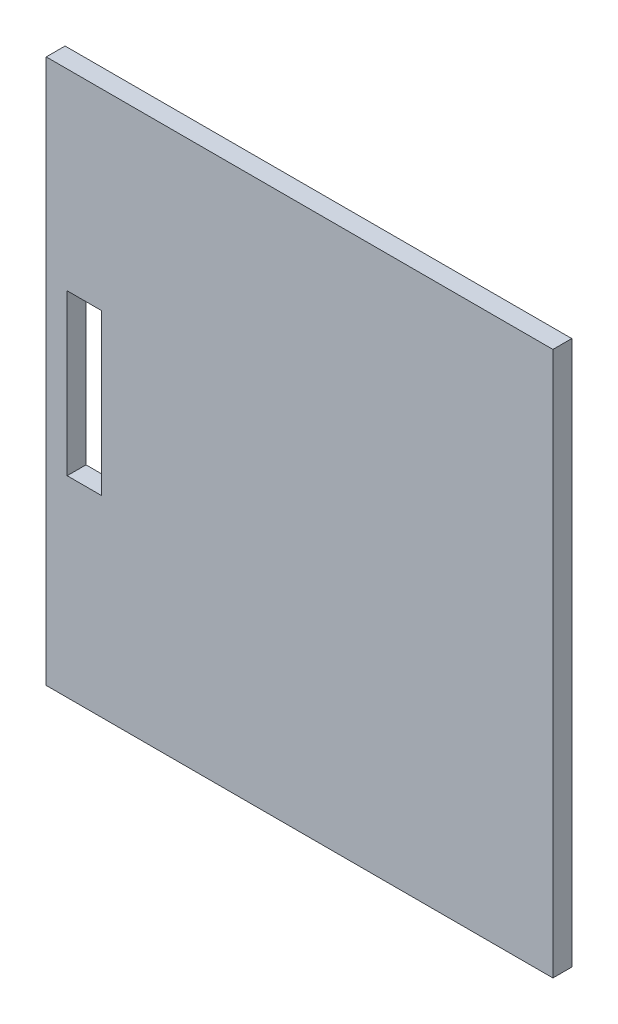
from build123d import *

# Parameters (mm, degrees)
SKETCH1_W           = 121
SKETCH1_H           = 130
SKETCH1_W_2         = 8.2
SKETCH1_H_2         = 38.25
BOSS_EXTRUDE1_DEPTH = 4.5


with BuildPart() as part:
    # Sketch1 → Boss-Extrude1 (new body)
    with BuildSketch(Plane.XY):
        Rectangle(SKETCH1_W, SKETCH1_H)
        with Locations((-51.4, 0)):
            Rectangle(SKETCH1_W_2, SKETCH1_H_2, mode=Mode.SUBTRACT)
    extrude(amount=BOSS_EXTRUDE1_DEPTH)


solid = part.part
